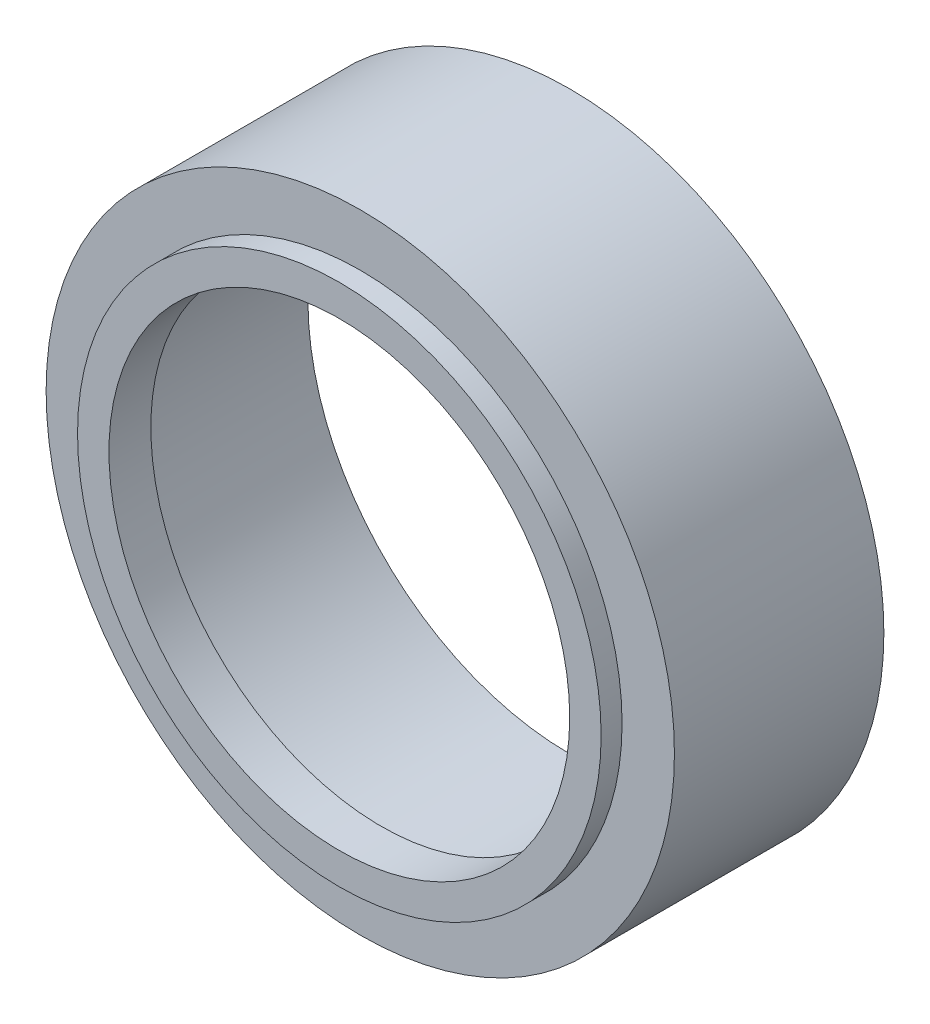
from build123d import *

# Parameters (mm, degrees)
ESQUISSE1_R             = 15
BOSS_EXTRU_1_DEPTH      = 10
ESQUISSE2_R             = 12.5
BOSS_EXTRU_2_DEPTH      = 1
ESQUISSE3_R             = 11
ENL_V_MAT_EXTRU_1_DEPTH = 2
ESQUISSE4_R             = 12.5
ENL_V_MAT_EXTRU_2_DEPTH = 9


with BuildPart() as part:
    # Esquisse1 → Boss.-Extru.1 (new body)
    with BuildSketch(Plane.XY):
        Circle(ESQUISSE1_R)
    extrude(amount=BOSS_EXTRU_1_DEPTH)

    # Esquisse2 → Boss.-Extru.2 (add)
    with BuildSketch(Plane.XY.offset(10)):
        Circle(ESQUISSE2_R)
    extrude(amount=BOSS_EXTRU_2_DEPTH)

    # Esquisse3 → Enlèv. mat.-Extru.1 (cut)
    with BuildSketch(Plane.XY.offset(11)):
        Circle(ESQUISSE3_R)
    extrude(amount=-ENL_V_MAT_EXTRU_1_DEPTH, mode=Mode.SUBTRACT)

    # Esquisse4 → Enlèv. mat.-Extru.2 (cut)
    with BuildSketch(Plane(origin=(0, 0, 0), x_dir=(-1, 0, 0), z_dir=(0, 0, -1))):
        with Locations(Location((0, 0, 0), (0, 0, 180))):
            Circle(ESQUISSE4_R)
    extrude(amount=-ENL_V_MAT_EXTRU_2_DEPTH, mode=Mode.SUBTRACT)


solid = part.part
